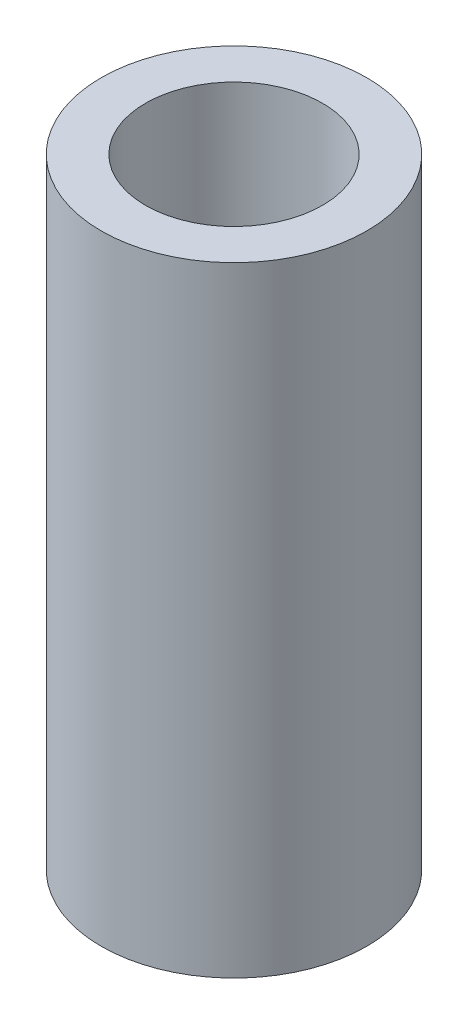
from build123d import *

# Parameters (mm, degrees)
SKETCH1_W          = 3
SKETCH1_H          = 14
SKETCH2_R          = 2
CUT_EXTRUDE1_DEPTH = 15.628738838


with BuildPart() as part:
    # Sketch1 → Revolve1 (revolve)
    with BuildSketch(Plane.XY, mode=Mode.PRIVATE) as revolve1_sk:
        with Locations((-1.5, 7)):
            Rectangle(SKETCH1_W, SKETCH1_H)
    revolve(revolve1_sk.sketch.rotate(Axis((0, -2.689983831, 0), (0, 1, 0)), 270), axis=Axis((0, -2.689983831, 0), (0, 1, 0)))

    # Sketch2 → Cut-Extrude1 (cut, through all)
    with BuildSketch(Plane(origin=(0, 0, 0), x_dir=(1, 0, 0), z_dir=(0, 1, 0))):
        with Locations(Location((0, 0, 0), (0, 0, 270))):
            Circle(SKETCH2_R)
    extrude(amount=CUT_EXTRUDE1_DEPTH, mode=Mode.SUBTRACT)


solid = part.part
